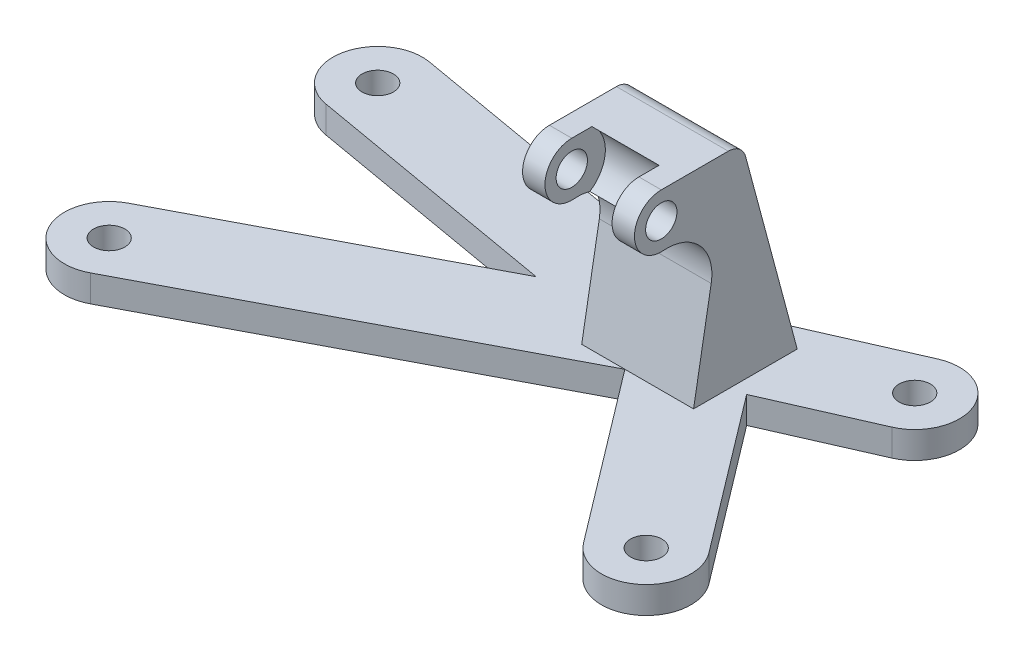
from build123d import *

# Parameters (mm, degrees)
SKETCH1_R           = 1.75
BOSS_EXTRUDE1_DEPTH = 3
SKETCH2_R           = 1.75
BOSS_EXTRUDE2_DEPTH = 6.25
SKETCH3_R           = 3.75
CUT_EXTRUDE1_DEPTH  = 3.75


with BuildPart() as part:
    # Sketch1 → Boss-Extrude1 (new body)
    with BuildSketch(Plane(origin=(0, 0, 0), x_dir=(1, 0, 0), z_dir=(0, 1, 0))):
        with BuildLine():
            Line((-45.257003151, -18.071250027), (-15.343449858, -2.395547337))
            Line((-15.343449858, -2.395547337), (-43.796551891, 2.574578453))
            ThreePointArc((-43.796551891, 2.574578453), (-47.861611547, 8.360361891), (-42.075828109, 12.425421547))
            Line((-42.075828109, 12.425421547), (-0.628357098, 5.185467732))
            Line((-0.628357098, 5.185467732), (15.051932182, 12.077373444))
            ThreePointArc((15.051932182, 12.077373444), (21.641183444, 9.511877818), (19.075687818, 2.922626556))
            Line((19.075687818, 2.922626556), (7.812998809, -2.027625912))
            Line((7.812998809, -2.027625912), (21.047705857, -19.478647024))
            ThreePointArc((21.047705857, -19.478647024), (20.085162976, -26.483895857), (13.079914143, -25.521352976))
            Line((13.079914143, -25.521352976), (-1.427051817, -6.392756601))
            Line((-1.427051817, -6.392756601), (-40.615376849, -26.928749973))
            ThreePointArc((-40.615376849, -26.928749973), (-47.364939973, -24.820813151), (-45.257003151, -18.071250027))
        make_face()
        with Locations(Location((-42.93619, -22.5, 0), (0, 0, 270))):
            Circle(SKETCH1_R, mode=Mode.SUBTRACT)
        with Locations(Location((-42.93619, 7.5, 0), (0, 0, 270))):
            Circle(SKETCH1_R, mode=Mode.SUBTRACT)
        with Locations(Location((17.06381, 7.5, 0), (0, 0, 270))):
            Circle(SKETCH1_R, mode=Mode.SUBTRACT)
        with Locations(Location((17.06381, -22.5, 0), (0, 0, 270))):
            Circle(SKETCH1_R, mode=Mode.SUBTRACT)
    extrude(amount=BOSS_EXTRUDE1_DEPTH)

    # Sketch2 → Boss-Extrude2 (add, symmetric)
    with BuildSketch(Plane(origin=(0, 0, 0), x_dir=(0, 0, -1), z_dir=(1, 0, 0))):
        with BuildLine():
            Line((-6.392756601, 3), (-4.425253098, 14.158266845))
            ThreePointArc((-4.425253098, 14.158266845), (-5.653060678, 18.393683854), (-9.755984449, 20.0099404))
            ThreePointArc((-9.755984449, 20.0099404), (-12.99751387, 22.877891031), (-10, 26))
            Line((-10, 26), (-2.51201767, 26))
            ThreePointArc((-2.51201767, 26), (-1.294494812, 25.586706681), (-0.580166017, 24.51763809))
            Line((-0.580166017, 24.51763809), (5.185467732, 3))
            Line((5.185467732, 3), (-6.392756601, 3))
        make_face()
        with Locations((-10, 23)):
            Circle(SKETCH2_R, mode=Mode.SUBTRACT)
    extrude(amount=BOSS_EXTRUDE2_DEPTH, both=True)

    # Sketch3 → Cut-Extrude1 (cut, symmetric)
    with BuildSketch(Plane(origin=(0, 0, 0), x_dir=(0, 0, -1), z_dir=(1, 0, 0))):
        with Locations((-10, 23)):
            Circle(SKETCH3_R)
    extrude(amount=CUT_EXTRUDE1_DEPTH, both=True, mode=Mode.SUBTRACT)


solid = part.part
